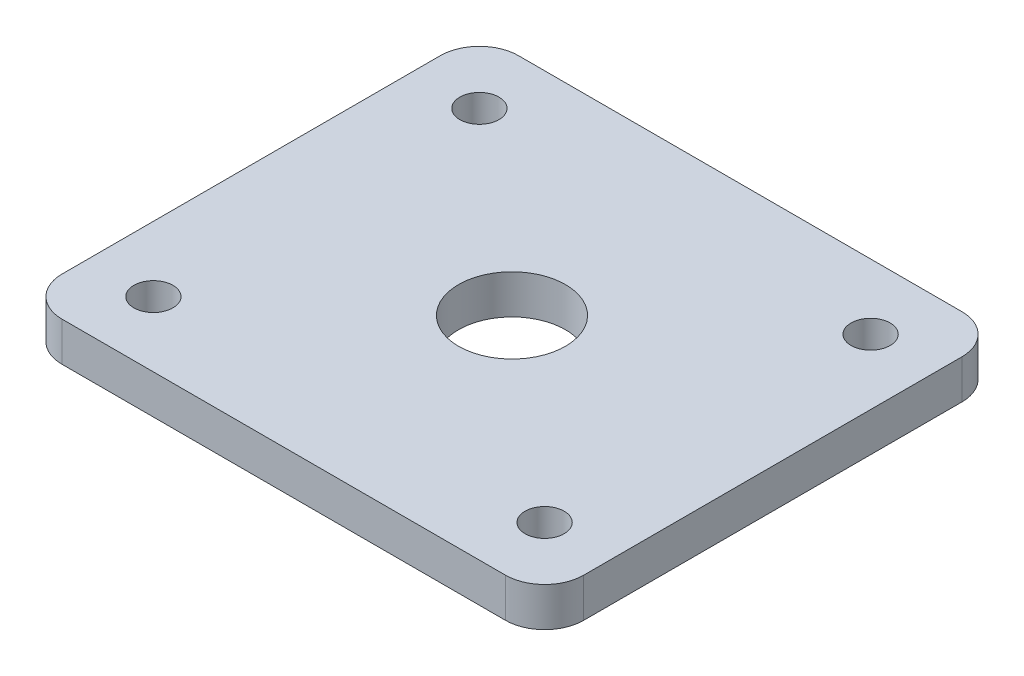
from build123d import *

# Parameters (mm, degrees)
SKETCH1_W           = 40
SKETCH1_H           = 35
SKETCH1_R           = 1.5
SKETCH1_R_2         = 4.1
BOSS_EXTRUDE1_DEPTH = 3
FILLET1_R           = 3


with BuildPart() as part:
    # Sketch1 → Boss-Extrude1 (new body)
    with BuildSketch(Plane(origin=(0, 0, 0), x_dir=(1, 0, 0), z_dir=(0, 1, 0))):
        with Locations((15, 12.5)):
            Rectangle(SKETCH1_W, SKETCH1_H)
        Circle(SKETCH1_R, mode=Mode.SUBTRACT)
        with Locations((30, 0)):
            Circle(SKETCH1_R, mode=Mode.SUBTRACT)
        with Locations((0, 25)):
            Circle(SKETCH1_R, mode=Mode.SUBTRACT)
        with Locations((30, 25)):
            Circle(SKETCH1_R, mode=Mode.SUBTRACT)
        with Locations((15, 12.5)):
            Circle(SKETCH1_R_2, mode=Mode.SUBTRACT)
    extrude(amount=BOSS_EXTRUDE1_DEPTH)

    # Fillet1
    fillet1_edges = [part.edges().sort_by_distance(p)[0] for p in [
        (35, 1.5, 5),
        (-5, 1.5, 5),
        (35, 1.5, -30),
        (-5, 1.5, -30),
    ]]
    fillet(fillet1_edges, radius=FILLET1_R)


solid = part.part
